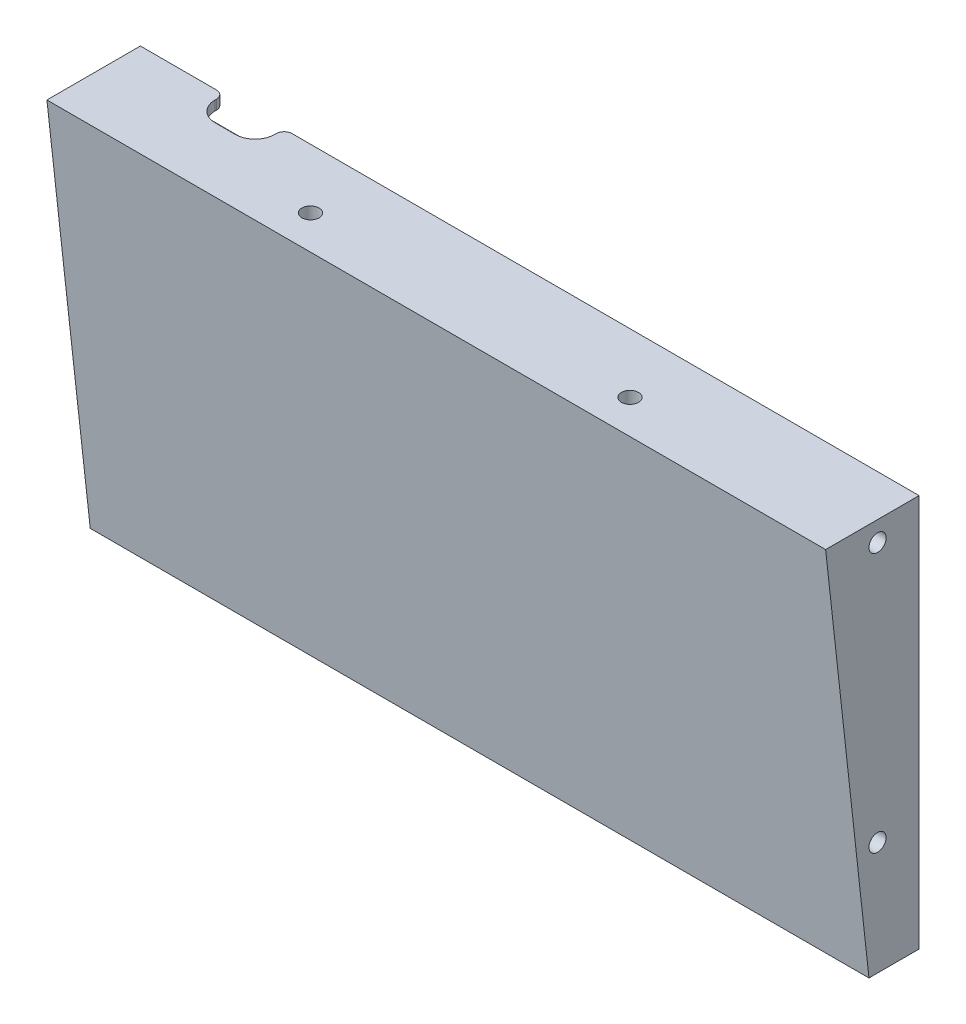
from build123d import *

# Parameters (mm, degrees)
SKETCH1_R           = 2.15
SKETCH1_W           = 3
SKETCH1_H           = 12.65
SKETCH1_H_2         = 12.75
BOSS_EXTRUDE1_DEPTH = 3.15085709
BOSS_EXTRUDE2_START = 3.150857
SKETCH1_3_R         = 2.15
SKETCH1_3_W         = 3
SKETCH1_3_H         = 6.4
SKETCH1_3_H_2       = 12.65
SKETCH1_3_H_3       = 12.75
SKETCH1_3_H_4       = 6.3
BOSS_EXTRUDE2_DEPTH = 3
SKETCH1_4_W         = 194.976
SKETCH1_4_H         = 98.329
SKETCH1_4_W_2       = 189.776
SKETCH1_4_H_2       = 93.129
BOSS_EXTRUDE4_DEPTH = 6.15085709
BOSS_EXTRUDE5_DEPTH = 194.976
SKETCH5_R           = 2.15
CUT_EXTRUDE2_DEPTH  = 4
SKETCH6_R           = 2.15
CUT_EXTRUDE3_DEPTH  = 4
CUT_EXTRUDE4_START  = -190.976
SKETCH6_2_R         = 2.15
CUT_EXTRUDE4_DEPTH  = 4
BOSS_EXTRUDE6_START = -1.6
SKETCH1_5_W         = 194.976
SKETCH1_5_H         = 98.329
SKETCH1_5_W_2       = 189.776
SKETCH1_5_H_2       = 93.129
BOSS_EXTRUDE6_DEPTH = 1.6
SKETCH7_R           = 3
CUT_EXTRUDE5_DEPTH  = 2.6
CUT_EXTRUDE6_START  = -194.976
SKETCH7_2_R         = 3
CUT_EXTRUDE6_DEPTH  = 2.6
BOSS_EXTRUDE7_START = -1
SKETCH9_W           = 2.4
SKETCH9_H           = 87.377932023
SKETCH9_H_2         = 4.078932023
SKETCH9_W_2         = 190.176
SKETCH9_H_3         = 2.4
SKETCH9_H_4         = 4.472135954
BOSS_EXTRUDE7_DEPTH = 5.8
CUT_EXTRUDE7_DEPTH  = 2.4
FILLET1_R           = 2


with BuildPart() as part:
    # Sketch1 → Boss-Extrude1 (new body)
    # profile 1 of 5: a face of its own
    with BuildSketch(Plane.XY):
        Polygon((94.888, 46.5645), (-94.888, 46.5645), (-94.888, -46.5645), (94.888, -46.5645), (94.888, -32.548850543), (91.888, -32.548850543), (91.888, -40.5645), (-87.888, -40.5645), (-87.888, 44.0645), (64.046820121, 44.0645), (69.267179879, 44.0645), (91.888, 44.0645), (91.888, 31.001149457), (94.888, 31.001149457), align=None)
        with Locations(Location((-91.11, -43.4975, 0), (0, 0, 180))):
            Circle(SKETCH1_R, mode=Mode.SUBTRACT)
        with Locations(Location((0.203, -43.4975, 0), (0, 0, 180))):
            Circle(SKETCH1_R, mode=Mode.SUBTRACT)
        with Locations(Location((91.389, -43.4975, 0), (0, 0, 180))):
            Circle(SKETCH1_R, mode=Mode.SUBTRACT)
        with Locations(Location((-91.11, 26.5025, 0), (0, 0, 180))):
            Circle(SKETCH1_R, mode=Mode.SUBTRACT)
    # profile 2 of 5: a face of its own
    with BuildSketch(Plane.XY):
        with Locations((93.388, 18.276149457)):
            Rectangle(SKETCH1_W, SKETCH1_H)
    # profile 3 of 5: a face of its own
    with BuildSketch(Plane.XY):
        with Locations((93.388, -0.823850543)):
            Rectangle(SKETCH1_W, SKETCH1_H_2)
    # profile 4 of 5: a face of its own
    with BuildSketch(Plane.XY):
        with Locations((93.388, -19.823850543)):
            Rectangle(SKETCH1_W, SKETCH1_H)
    # profile 5 of 5: a face of its own
    with BuildSketch(Plane.XY):
        with BuildLine():
            ThreePointArc((64.046820121, 44.0645), (66.657, 37.0335), (69.267179879, 44.0645))
            Line((69.267179879, 44.0645), (64.046820121, 44.0645))
        make_face()
        with Locations(Location((66.657, 41.0335, 0), (0, 0, 180))):
            Circle(SKETCH1_R, mode=Mode.SUBTRACT)
    extrude(amount=BOSS_EXTRUDE1_DEPTH)

    # Sketch1<3> → Boss-Extrude2 (add)
    # profile 1 of 15: a face of its own
    with BuildSketch(Plane.XY.offset(BOSS_EXTRUDE2_START)):
        Polygon((94.888, 46.5645), (-94.888, 46.5645), (-94.888, -46.5645), (94.888, -46.5645), (94.888, -32.548850543), (91.888, -32.548850543), (91.888, -40.5645), (-87.888, -40.5645), (-87.888, 44.0645), (64.046820121, 44.0645), (69.267179879, 44.0645), (91.888, 44.0645), (91.888, 31.001149457), (94.888, 31.001149457), align=None)
        with Locations(Location((-91.11, -43.4975, 0), (0, 0, 180))):
            Circle(SKETCH1_3_R, mode=Mode.SUBTRACT)
        with Locations(Location((0.203, -43.4975, 0), (0, 0, 180))):
            Circle(SKETCH1_3_R, mode=Mode.SUBTRACT)
        with Locations(Location((91.389, -43.4975, 0), (0, 0, 180))):
            Circle(SKETCH1_3_R, mode=Mode.SUBTRACT)
        with Locations(Location((-91.11, 26.5025, 0), (0, 0, 180))):
            Circle(SKETCH1_3_R, mode=Mode.SUBTRACT)
    # profile 2 of 15: a face of its own
    with BuildSketch(Plane.XY.offset(BOSS_EXTRUDE2_START)):
        with Locations((93.388, 8.751149457)):
            Rectangle(SKETCH1_3_W, SKETCH1_3_H)
    # profile 3 of 15: a face of its own
    with BuildSketch(Plane.XY.offset(BOSS_EXTRUDE2_START)):
        with Locations((93.388, 18.276149457)):
            Rectangle(SKETCH1_3_W, SKETCH1_3_H_2)
    # profile 4 of 15: a face of its own
    with BuildSketch(Plane.XY.offset(BOSS_EXTRUDE2_START)):
        with BuildLine():
            Line((91.888, 24.601149457), (91.888, 31.001149457))
            Line((91.888, 31.001149457), (91.888, 44.0645))
            Line((91.888, 44.0645), (69.267179879, 44.0645))
            ThreePointArc((69.267179879, 44.0645), (66.657, 37.0335), (64.046820121, 44.0645))
            Line((64.046820121, 44.0645), (-87.888, 44.0645))
            Line((-87.888, 44.0645), (-87.888, -40.5645))
            Line((-87.888, -40.5645), (91.888, -40.5645))
            Line((91.888, -40.5645), (91.888, -32.548850543))
            Line((91.888, -32.548850543), (91.888, -26.148850543))
            Line((91.888, -26.148850543), (91.888, -13.498850543))
            Line((91.888, -13.498850543), (91.888, -7.198850543))
            Line((91.888, -7.198850543), (91.888, 5.551149457))
            Line((91.888, 5.551149457), (91.888, 11.951149457))
            Line((91.888, 11.951149457), (91.888, 24.601149457))
        make_face()
    # profile 5 of 15: a face of its own
    with BuildSketch(Plane.XY.offset(BOSS_EXTRUDE2_START)):
        with Locations((93.388, -0.823850543)):
            Rectangle(SKETCH1_3_W, SKETCH1_3_H_3)
    # profile 6 of 15: a face of its own
    with BuildSketch(Plane.XY.offset(BOSS_EXTRUDE2_START)):
        with Locations((93.388, -10.348850543)):
            Rectangle(SKETCH1_3_W, SKETCH1_3_H_4)
    # profile 7 of 15: a face of its own
    with BuildSketch(Plane.XY.offset(BOSS_EXTRUDE2_START)):
        with Locations((93.388, -19.823850543)):
            Rectangle(SKETCH1_3_W, SKETCH1_3_H_2)
    # profile 8 of 15: a face of its own
    with BuildSketch(Plane.XY.offset(BOSS_EXTRUDE2_START)):
        with Locations((93.388, -29.348850543)):
            Rectangle(SKETCH1_3_W, SKETCH1_3_H)
    # profile 9 of 15: a face of its own
    with BuildSketch(Plane.XY.offset(BOSS_EXTRUDE2_START)):
        with Locations((93.388, 27.801149457)):
            Rectangle(SKETCH1_3_W, SKETCH1_3_H)
    # profile 10 of 15: a face of its own
    with BuildSketch(Plane.XY.offset(BOSS_EXTRUDE2_START)):
        with BuildLine():
            ThreePointArc((64.046820121, 44.0645), (66.657, 37.0335), (69.267179879, 44.0645))
            Line((69.267179879, 44.0645), (64.046820121, 44.0645))
        make_face()
        with Locations(Location((66.657, 41.0335, 0), (0, 0, 180))):
            Circle(SKETCH1_3_R, mode=Mode.SUBTRACT)
    # profile 11 of 15: a face of its own
    with BuildSketch(Plane.XY.offset(BOSS_EXTRUDE2_START)):
        with Locations(Location((66.657, 41.0335, 0), (0, 0, 180))):
            Circle(SKETCH1_3_R)
    # profile 12 of 15: a face of its own
    with BuildSketch(Plane.XY.offset(BOSS_EXTRUDE2_START)):
        with Locations(Location((91.389, -43.4975, 0), (0, 0, 180))):
            Circle(SKETCH1_3_R)
    # profile 13 of 15: a face of its own
    with BuildSketch(Plane.XY.offset(BOSS_EXTRUDE2_START)):
        with Locations(Location((0.203, -43.4975, 0), (0, 0, 180))):
            Circle(SKETCH1_3_R)
    # profile 14 of 15: a face of its own
    with BuildSketch(Plane.XY.offset(BOSS_EXTRUDE2_START)):
        with Locations(Location((-91.11, -43.4975, 0), (0, 0, 180))):
            Circle(SKETCH1_3_R)
    # profile 15 of 15: a face of its own
    with BuildSketch(Plane.XY.offset(BOSS_EXTRUDE2_START)):
        with Locations(Location((-91.11, 26.5025, 0), (0, 0, 180))):
            Circle(SKETCH1_3_R)
    extrude(amount=BOSS_EXTRUDE2_DEPTH)

    # Sketch1<4> → Boss-Extrude4 (add)
    with BuildSketch(Plane.XY):
        Rectangle(SKETCH1_4_W, SKETCH1_4_H)
        Rectangle(SKETCH1_4_W_2, SKETCH1_4_H_2, mode=Mode.SUBTRACT)
    extrude(amount=BOSS_EXTRUDE4_DEPTH)

    # Sketch4 → Boss-Extrude5 (add)
    with BuildSketch(Plane.ZY.offset(97.488)):
        Polygon((6.15085709, 49.1645), (17, 49.1645), (6.15085709, -49.1645), align=None)
    extrude(amount=-BOSS_EXTRUDE5_DEPTH)

    # Sketch5 → Cut-Extrude2 (cut)
    with BuildSketch(Plane(origin=(0, 49.1645, 0), x_dir=(1, 0, 0), z_dir=(0, 1, 0))):
        with Locations(Location((-40, -8.5, 0), (0, 0, 270))):
            Circle(SKETCH5_R)
        with Locations(Location((40, -8.5, 0), (0, 0, 270))):
            Circle(SKETCH5_R)
    extrude(amount=-CUT_EXTRUDE2_DEPTH, mode=Mode.SUBTRACT)

    # Sketch6 → Cut-Extrude3 (cut)
    with BuildSketch(Plane(origin=(97.488, 0, 0), x_dir=(0, 0, -1), z_dir=(1, 0, 0))):
        with Locations((-4, 44.1645)):
            Circle(SKETCH6_R)
        with Locations((-4, -20.8355)):
            Circle(SKETCH6_R)
    extrude(amount=-CUT_EXTRUDE3_DEPTH, mode=Mode.SUBTRACT)

    # Sketch6<2> → Cut-Extrude4 (cut)
    with BuildSketch(Plane(origin=(97.488, 0, 0), x_dir=(0, 0, -1), z_dir=(1, 0, 0)).offset(CUT_EXTRUDE4_START)):
        with Locations((-4, 44.1645)):
            Circle(SKETCH6_2_R)
        with Locations((-4, -20.8355)):
            Circle(SKETCH6_2_R)
    extrude(amount=-CUT_EXTRUDE4_DEPTH, mode=Mode.SUBTRACT)

    # Sketch1<5> → Boss-Extrude6 (add)
    with BuildSketch(Plane.XY.offset(BOSS_EXTRUDE6_START)):
        Rectangle(SKETCH1_5_W, SKETCH1_5_H)
        Rectangle(SKETCH1_5_W_2, SKETCH1_5_H_2, mode=Mode.SUBTRACT)
    extrude(amount=BOSS_EXTRUDE6_DEPTH)

    # Sketch7 → Cut-Extrude5 (cut)
    with BuildSketch(Plane.ZY.offset(97.488)):
        with Locations((-3.6, 40.4495)):
            Circle(SKETCH7_R)
    extrude(amount=-CUT_EXTRUDE5_DEPTH, mode=Mode.SUBTRACT)

    # Sketch7<2> → Cut-Extrude6 (cut)
    with BuildSketch(Plane.ZY.offset(97.488).offset(CUT_EXTRUDE6_START)):
        with Locations((-3.6, 40.4495)):
            Circle(SKETCH7_2_R)
    extrude(amount=CUT_EXTRUDE6_DEPTH, mode=Mode.SUBTRACT)

    # Sketch9 → Boss-Extrude7 (add)
    with BuildSketch(Plane(origin=(0, 0, -1.6), x_dir=(-1, 0, 0), z_dir=(0, 0, -1)).offset(BOSS_EXTRUDE7_START)):
        Polygon((-97.488, 49.1645), (-97.488, 42.685567977), (-95.088, 42.685567977), (-95.088, 46.7645), (-95.088, 49.1645), align=None)
        Polygon((-95.088, 49.1645), (-95.088, 46.7645), (95.088, 46.7645), (97.488, 46.7645), (97.488, 49.1645), align=None)
        with Locations((-96.288, -5.475533989)):
            Rectangle(SKETCH9_W, SKETCH9_H)
        with Locations((96.288, 44.725033989)):
            Rectangle(SKETCH9_W, SKETCH9_H_2)
        with Locations((96.288, -5.475533989)):
            Rectangle(SKETCH9_W, SKETCH9_H)
        with Locations((0, -47.9645)):
            Rectangle(SKETCH9_W_2, SKETCH9_H_3)
        with Locations((-96.288, 40.4495)):
            Rectangle(SKETCH9_W, SKETCH9_H_4)
        with Locations((96.288, 40.4495)):
            Rectangle(SKETCH9_W, SKETCH9_H_4)
    extrude(amount=BOSS_EXTRUDE7_DEPTH)

    # Sketch10 → Cut-Extrude7 (cut)
    with BuildSketch(Plane(origin=(0, 49.1645, 0), x_dir=(1, 0, 0), z_dir=(0, 1, 0))):
        with BuildLine():
            Line((-66.44559, 9.005), (-71.48559, 9.005))
            ThreePointArc((-71.48559, 9.005), (-74.024758171, 8.304132264), (-75.844887535, 6.4))
            Line((-75.844887535, 6.4), (-76.43559, 6.4))
            Line((-76.43559, 6.4), (-76.43559, 4.055))
            ThreePointArc((-76.43559, 4.055), (-74.985768567, 0.554821433), (-71.48559, -0.895))
            Line((-71.48559, -0.895), (-66.44559, -0.895))
            ThreePointArc((-66.44559, -0.895), (-62.945411433, 0.554821433), (-61.49559, 4.055))
            Line((-61.49559, 4.055), (-61.49559, 6.4))
            Line((-61.49559, 6.4), (-62.086292465, 6.4))
            ThreePointArc((-62.086292465, 6.4), (-63.906421829, 8.304132264), (-66.44559, 9.005))
        make_face()
    extrude(amount=-CUT_EXTRUDE7_DEPTH, mode=Mode.SUBTRACT)

    # Fillet1
    fillet1_edges = [part.edges().sort_by_distance(p)[0] for p in [
        (-76.43559, 47.9645, -6.4),
        (-61.49559, 47.9645, -6.4),
    ]]
    fillet(fillet1_edges, radius=FILLET1_R)


solid = part.part
